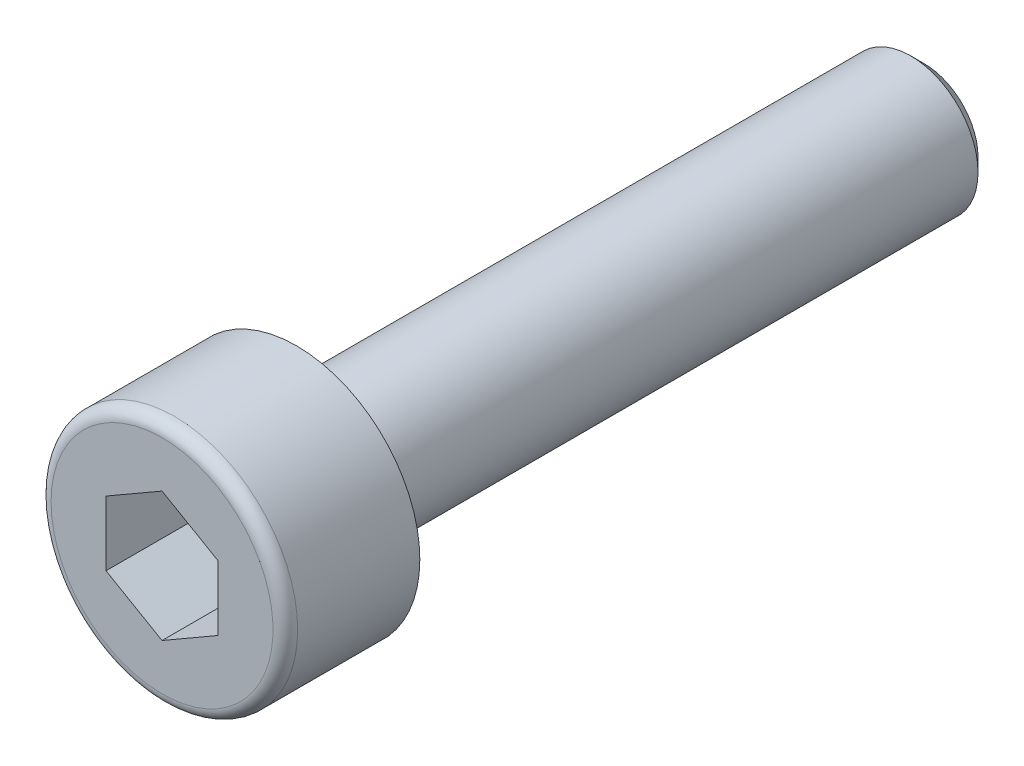
from build123d import *

# Parameters (mm, degrees)
CUT_EXTRUDE_1_DEPTH = 1.925
FILLET_1_R          = 0.275
CHAMFER_1_SIZE      = 0.3


with BuildPart() as part:
    # 草图3 → 旋转1 (revolve)
    with BuildSketch(Plane(origin=(0, 0, 0), x_dir=(0, 0, -1), z_dir=(1, 0, 0)), mode=Mode.PRIVATE) as revolve_1_sk:
        Polygon((-3, 0), (-3, 2.75), (0, 2.75), (0, 1.5), (14, 1.5), (14, 0), align=None)
    revolve(revolve_1_sk.sketch.rotate(Axis((0, 0, 3), (0, 0, -1)), 90), axis=Axis((0, 0, 3), (0, 0, -1)))

    # 草图4 → 切除-拉伸1 (cut)
    with BuildSketch(Plane.XY.offset(3)):
        Polygon((0, 1.443375673), (-1.25, 0.721687836), (-1.25, -0.721687836), (0, -1.443375673), (1.25, -0.721687836), (1.25, 0.721687836), align=None)
    extrude(amount=-CUT_EXTRUDE_1_DEPTH, mode=Mode.SUBTRACT)

    # 圆角1
    fillet_1_edges = [part.edges().sort_by_distance(p)[0] for p in [
        (-2.75, 0, 3),
    ]]
    fillet(fillet_1_edges, radius=FILLET_1_R)

    # 倒角1
    chamfer_1_edges = [part.edges().sort_by_distance(p)[0] for p in [
        (-1.5, 0, -14),
    ]]
    chamfer(chamfer_1_edges, length=CHAMFER_1_SIZE)


solid = part.part
